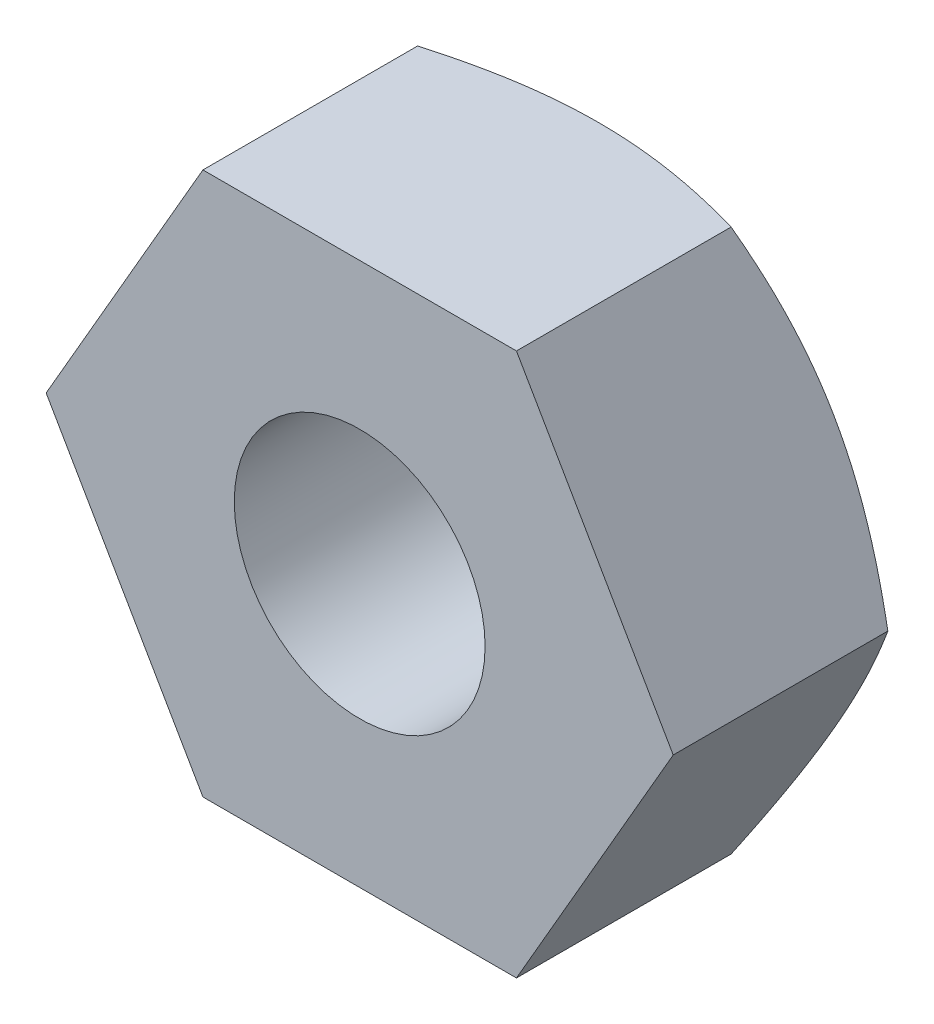
from build123d import *

# Parameters (mm, degrees)
SZKIC1_R                    = 2
DODANIE_WYCI_GNI_CIE1_DEPTH = 4
SZKIC2_OUTSIDE_W            = 28.62
SZKIC2_OUTSIDE_H            = 27.28
SZKIC2_OUTSIDE_R            = 4
WYTNIJ_WYCI_GNI_CIE1_DEPTH  = 4
WYTNIJ_WYCI_GNI_CIE1_DRAFT  = -60


with BuildPart() as part:
    # Szkic1 → Dodanie-wyciągnięcie1 (new body)
    with BuildSketch(Plane.XY):
        Polygon((5, 0), (2.5, 4.330127019), (-2.5, 4.330127019), (-5, 0), (-2.5, -4.330127019), (2.5, -4.330127019), align=None)
        Circle(SZKIC1_R, mode=Mode.SUBTRACT)
    extrude(amount=DODANIE_WYCI_GNI_CIE1_DEPTH)


with BuildPart() as wytnij_wyci_gni_cie1_tool:
    # Szkic2 outside → Wytnij-wyciągnięcie1 (with draft: the straight prism first)
    with BuildSketch(Plane(origin=(0, 0, 0), x_dir=(-1, 0, 0), z_dir=(0, 0, -1))):
        Rectangle(SZKIC2_OUTSIDE_W, SZKIC2_OUTSIDE_H)
        Circle(SZKIC2_OUTSIDE_R, mode=Mode.SUBTRACT)
    extrude(amount=-WYTNIJ_WYCI_GNI_CIE1_DEPTH)
    # Wytnij-wyciągnięcie1: the draft: its side faces are tilted about the plane it starts from
    wytnij_wyci_gni_cie1_sides = [wytnij_wyci_gni_cie1_tool.faces().sort_by_distance(p)[0] for p in [
        (0, -13.64, 2),
        (-14.31, 0, 2),
        (0, 13.64, 2),
        (14.31, 0, 2),
        (4, 0, 2),
    ]]
    draft(wytnij_wyci_gni_cie1_sides, Plane(origin=(0, 0, 0), x_dir=(-1, 0, 0), z_dir=(0, 0, -1)), WYTNIJ_WYCI_GNI_CIE1_DRAFT)


with BuildPart() as part_1:
    add(part.part)

    # Wytnij-wyciągnięcie1: cut by wytnij_wyci_gni_cie1_tool
    add(wytnij_wyci_gni_cie1_tool.part, mode=Mode.SUBTRACT)


solid = part_1.part
